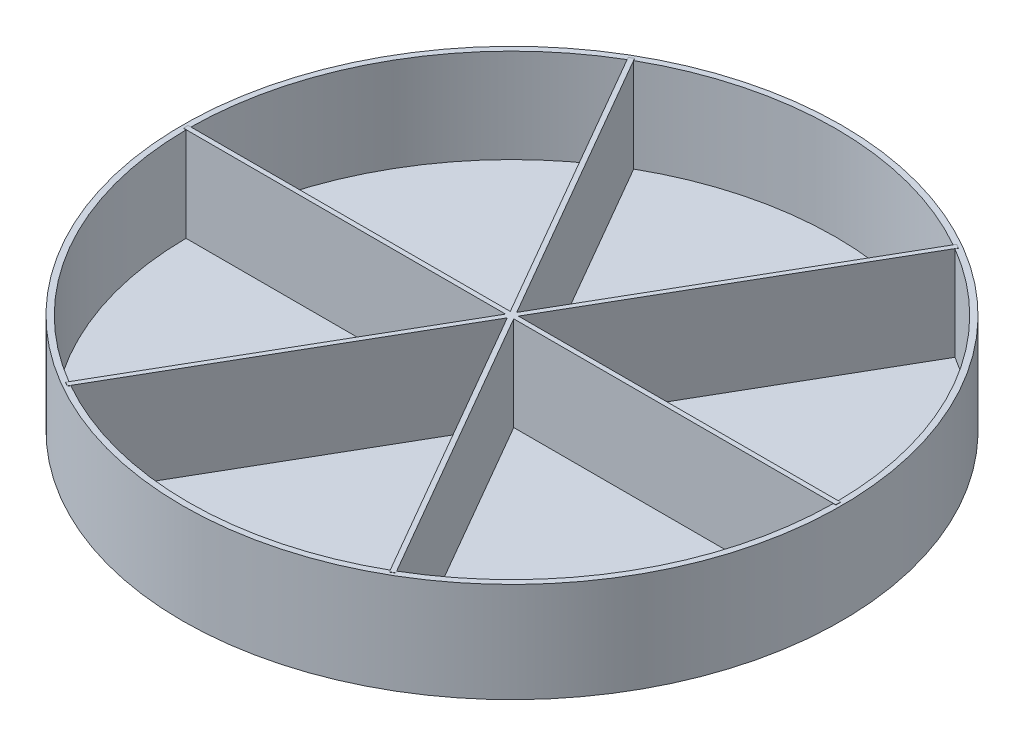
from build123d import *

# Parameters (mm, degrees)
SKETCH1_R           = 177.8
BOSS_EXTRUDE1_DEPTH = 53.848
SKETCH2_R           = 174.625
CUT_EXTRUDE1_DEPTH  = 50.673
SKETCH3_W           = 351.952724098
SKETCH3_H           = 2.54
EXTRUDE_THIN1_DEPTH = 50.8


with BuildPart() as part:
    # Sketch1 → Boss-Extrude1 (new body)
    with BuildSketch(Plane(origin=(0, 0, 0), x_dir=(1, 0, 0), z_dir=(0, 1, 0))):
        with Locations(Location((0, 0, 0), (0, 0, 270))):
            Circle(SKETCH1_R)
    extrude(amount=BOSS_EXTRUDE1_DEPTH)

    # Sketch2 → Cut-Extrude1 (cut)
    with BuildSketch(Plane(origin=(0, 53.848, 0), x_dir=(1, 0, 0), z_dir=(0, 1, 0))):
        with Locations(Location((0, 0, 0), (0, 0, 270))):
            Circle(SKETCH2_R)
    extrude(amount=-CUT_EXTRUDE1_DEPTH, mode=Mode.SUBTRACT)

    # Sketch3 → Extrude-Thin1 (add)
    with BuildSketch(Plane(origin=(0, 3.175, 0), x_dir=(1, 0, 0), z_dir=(0, 1, 0))):
        Polygon((86.888328762, 153.035), (-89.088033287, -151.765), (-86.888328762, -153.035), (89.088033287, 151.765), align=None)
        Polygon((-89.088033287, 151.765), (86.888328762, -153.035), (89.088033287, -151.765), (-86.888328762, 153.035), align=None)
        Rectangle(SKETCH3_W, SKETCH3_H)
    extrude(amount=EXTRUDE_THIN1_DEPTH)


solid = part.part
